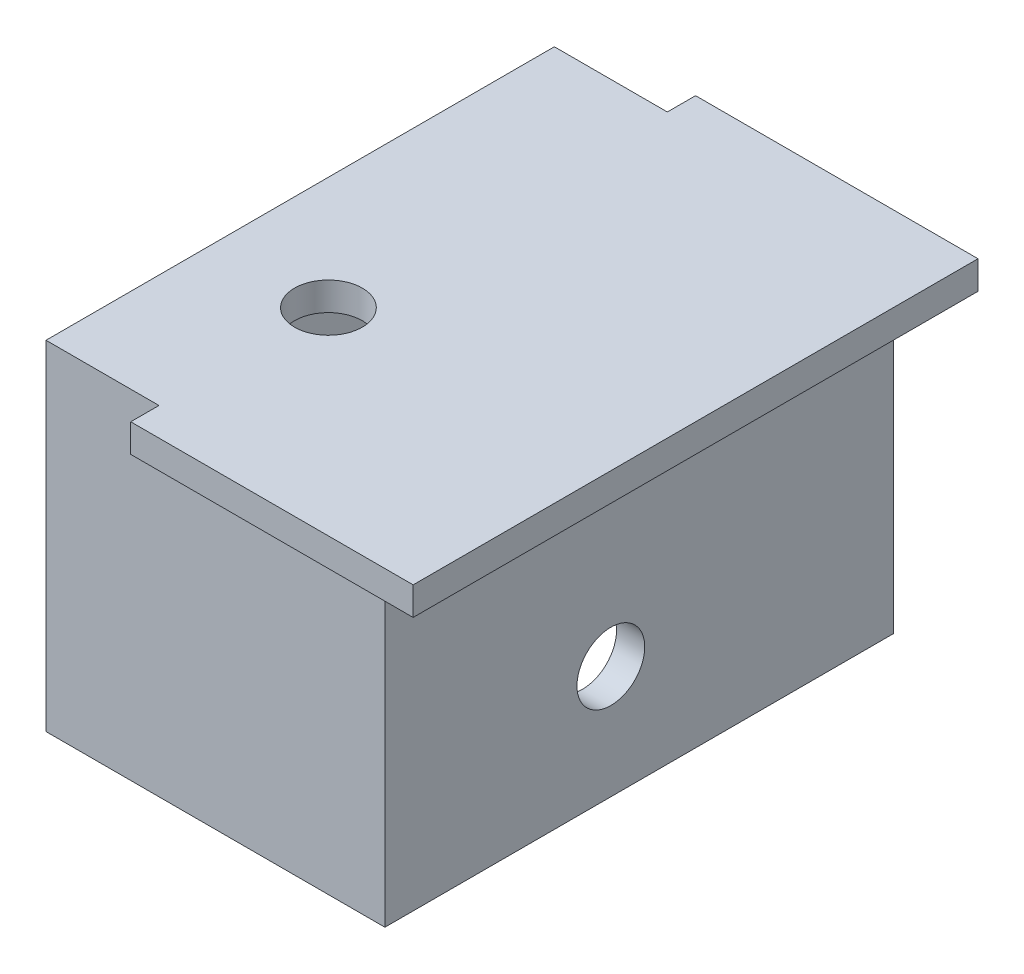
from build123d import *

# Parameters (mm, degrees)
BOSS_EXTRUDE1_DEPTH = 100
SKETCH2_W           = 5
SKETCH2_H           = 55
CUT_EXTRUDE2_DEPTH  = 5
SKETCH3_W           = 5
SKETCH3_H           = 55
CUT_EXTRUDE3_DEPTH  = 5
SKETCH4_W           = 15
SKETCH4_H           = 5
CUT_EXTRUDE4_DEPTH  = 5
SKETCH5_W           = 15
SKETCH5_H           = 5
CUT_EXTRUDE5_DEPTH  = 5
SKETCH6_R           = 6
CUT_EXTRUDE6_DEPTH  = 10
SKETCH7_W           = 5
SKETCH7_H           = 90
BOSS_EXTRUDE2_DEPTH = 55
SKETCH8_R           = 6
CUT_EXTRUDE7_DEPTH  = 80
SKETCH9_W           = 5
SKETCH9_H           = 25
CUT_EXTRUDE8_DEPTH  = 100
SKETCH10_W          = 5
SKETCH10_H          = 5
CUT_EXTRUDE9_DEPTH  = 5
SKETCH11_W          = 5
SKETCH11_H          = 5
CUT_EXTRUDE10_DEPTH = 5
SKETCH12_W          = 50
SKETCH12_H          = 5
BOSS_EXTRUDE3_DEPTH = 55


with BuildPart() as part:
    # Sketch1 → Boss-Extrude1 (new body)
    with BuildSketch(Plane.XY):
        Polygon((0, 0), (-65, 0), (-65, -55), (-70, -55), (-70, 0), (-70, 30), (-65, 30), (-65, 5), (0, 5), align=None)
    extrude(amount=BOSS_EXTRUDE1_DEPTH)

    # Sketch2 → Cut-Extrude2 (cut)
    with BuildSketch(Plane.XY.offset(100)):
        with Locations((-67.5, -27.5)):
            Rectangle(SKETCH2_W, SKETCH2_H)
    extrude(amount=-CUT_EXTRUDE2_DEPTH, mode=Mode.SUBTRACT)

    # Sketch3 → Cut-Extrude3 (cut)
    with BuildSketch(Plane(origin=(0, 0, 0), x_dir=(-1, 0, 0), z_dir=(0, 0, -1))):
        with Locations((67.5, -27.5)):
            Rectangle(SKETCH3_W, SKETCH3_H)
    extrude(amount=-CUT_EXTRUDE3_DEPTH, mode=Mode.SUBTRACT)

    # Sketch4 → Cut-Extrude4 (cut)
    with BuildSketch(Plane.XY.offset(100)):
        with Locations((-57.5, 2.5)):
            Rectangle(SKETCH4_W, SKETCH4_H)
    extrude(amount=-CUT_EXTRUDE4_DEPTH, mode=Mode.SUBTRACT)

    # Sketch5 → Cut-Extrude5 (cut)
    with BuildSketch(Plane(origin=(0, 0, 0), x_dir=(-1, 0, 0), z_dir=(0, 0, -1))):
        with Locations((57.5, 2.5)):
            Rectangle(SKETCH5_W, SKETCH5_H)
    extrude(amount=-CUT_EXTRUDE5_DEPTH, mode=Mode.SUBTRACT)

    # Sketch6 → Cut-Extrude6 (cut)
    with BuildSketch(Plane(origin=(0, 5, 0), x_dir=(1, 0, 0), z_dir=(0, 1, 0))):
        with Locations(Location((-50, -65, 0), (0, 0, 180))):
            Circle(SKETCH6_R)
    extrude(amount=-CUT_EXTRUDE6_DEPTH, mode=Mode.SUBTRACT)

    # Sketch7 → Boss-Extrude2 (add)
    with BuildSketch(Plane.XZ):
        with Locations((-12.5, 50)):
            Rectangle(SKETCH7_W, SKETCH7_H)
    extrude(amount=BOSS_EXTRUDE2_DEPTH)

    # Sketch8 → Cut-Extrude7 (cut)
    with BuildSketch(Plane.ZY.offset(70)):
        with Locations(Location((55, -35, 0), (0, 0, 270))):
            Circle(SKETCH8_R)
    extrude(amount=-CUT_EXTRUDE7_DEPTH, mode=Mode.SUBTRACT)

    # Sketch9 → Cut-Extrude8 (cut)
    with BuildSketch(Plane.XY.offset(100)):
        with Locations((-67.5, 17.5)):
            Rectangle(SKETCH9_W, SKETCH9_H)
    extrude(amount=-CUT_EXTRUDE8_DEPTH, mode=Mode.SUBTRACT)

    # Sketch10 → Cut-Extrude9 (cut)
    with BuildSketch(Plane.XY.offset(100)):
        with Locations((-67.5, 2.5)):
            Rectangle(SKETCH10_W, SKETCH10_H)
    extrude(amount=-CUT_EXTRUDE9_DEPTH, mode=Mode.SUBTRACT)

    # Sketch11 → Cut-Extrude10 (cut)
    with BuildSketch(Plane(origin=(0, 0, 0), x_dir=(-1, 0, 0), z_dir=(0, 0, -1))):
        with Locations((67.5, 2.5)):
            Rectangle(SKETCH11_W, SKETCH11_H)
    extrude(amount=-CUT_EXTRUDE10_DEPTH, mode=Mode.SUBTRACT)

    # Sketch12 → Boss-Extrude3 (add)
    with BuildSketch(Plane.XZ):
        with Locations((-40, 7.5)):
            Rectangle(SKETCH12_W, SKETCH12_H)
        with Locations((-40, 92.5)):
            Rectangle(SKETCH12_W, SKETCH12_H)
    extrude(amount=BOSS_EXTRUDE3_DEPTH)


solid = part.part
